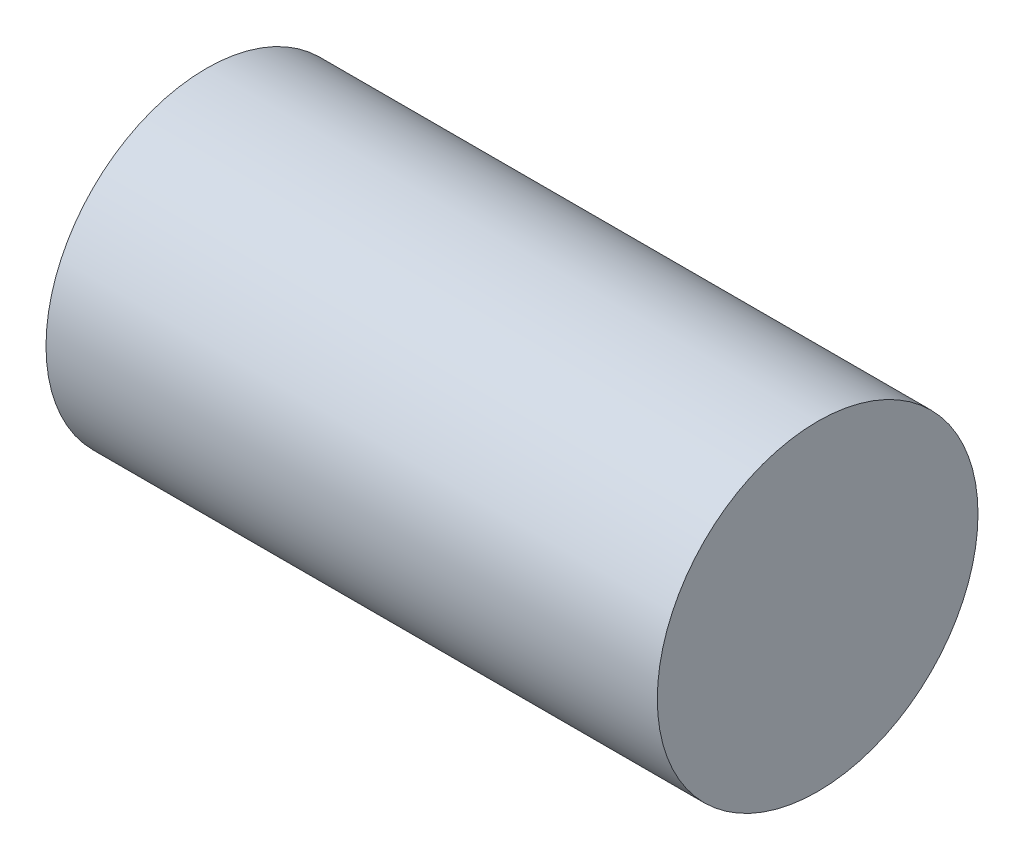
from build123d import *

# Parameters (mm, degrees)
SKETCH1_R           = 16
BOSS_EXTRUDE1_DEPTH = 61
SKETCH2_R           = 11
BOSS_EXTRUDE2_DEPTH = 2
SKETCH3_R           = 1.5
CUT_EXTRUDE1_DEPTH  = 4
SKETCH4_R           = 2.5
CUT_EXTRUDE2_DEPTH  = 2


with BuildPart() as part:
    # Sketch1 → Boss-Extrude1 (new body)
    with BuildSketch(Plane(origin=(0, 0, 0), x_dir=(0, 0, -1), z_dir=(1, 0, 0))):
        with Locations(Location((0, 0, 0), (0, 0, 180))):
            Circle(SKETCH1_R)
    extrude(amount=BOSS_EXTRUDE1_DEPTH)

    # Sketch2 → Boss-Extrude2 (add)
    with BuildSketch(Plane.ZY):
        Circle(SKETCH2_R)
    extrude(amount=BOSS_EXTRUDE2_DEPTH)

    # Sketch3 → Cut-Extrude1 (cut)
    with BuildSketch(Plane.ZY):
        with Locations((0, 13.5)):
            Circle(SKETCH3_R)
        with Locations((11.691342951, 6.75)):
            Circle(SKETCH3_R)
        with Locations((11.691342951, -6.75)):
            Circle(SKETCH3_R)
        with Locations((0, -13.5)):
            Circle(SKETCH3_R)
        with Locations((-11.691342951, -6.75)):
            Circle(SKETCH3_R)
        with Locations((-11.691342951, 6.75)):
            Circle(SKETCH3_R)
    extrude(amount=-CUT_EXTRUDE1_DEPTH, mode=Mode.SUBTRACT)

    # Sketch4 → Cut-Extrude2 (cut)
    with BuildSketch(Plane.ZY.offset(2)):
        Circle(SKETCH4_R)
    extrude(amount=-CUT_EXTRUDE2_DEPTH, mode=Mode.SUBTRACT)


solid = part.part
